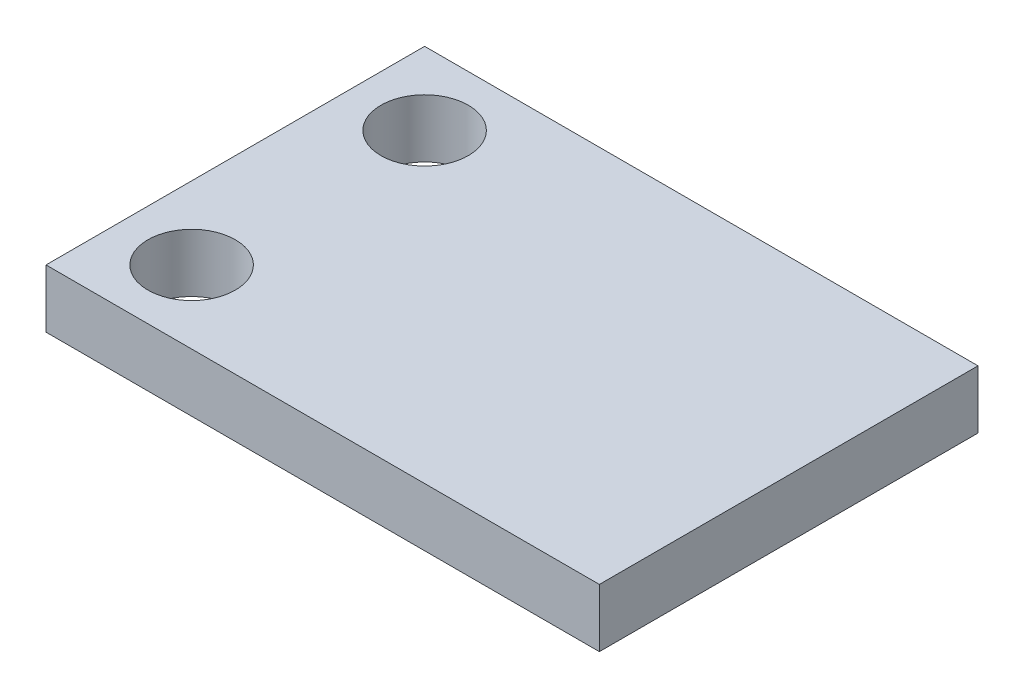
from build123d import *

# Parameters (mm, degrees)
SKETCH1_W           = 19
SKETCH1_H           = 13
SKETCH1_R           = 1.5
BOSS_EXTRUDE1_DEPTH = 2


with BuildPart() as part:
    # Sketch1 → Boss-Extrude1 (new body)
    with BuildSketch(Plane(origin=(0, 0, 0), x_dir=(1, 0, 0), z_dir=(0, 1, 0))):
        Rectangle(SKETCH1_W, SKETCH1_H)
        with Locations(Location((-7, 4, 0), (0, 0, 270))):
            Circle(SKETCH1_R, mode=Mode.SUBTRACT)
        with Locations(Location((-7, -4, 0), (0, 0, 90))):
            Circle(SKETCH1_R, mode=Mode.SUBTRACT)
    extrude(amount=BOSS_EXTRUDE1_DEPTH)


solid = part.part
